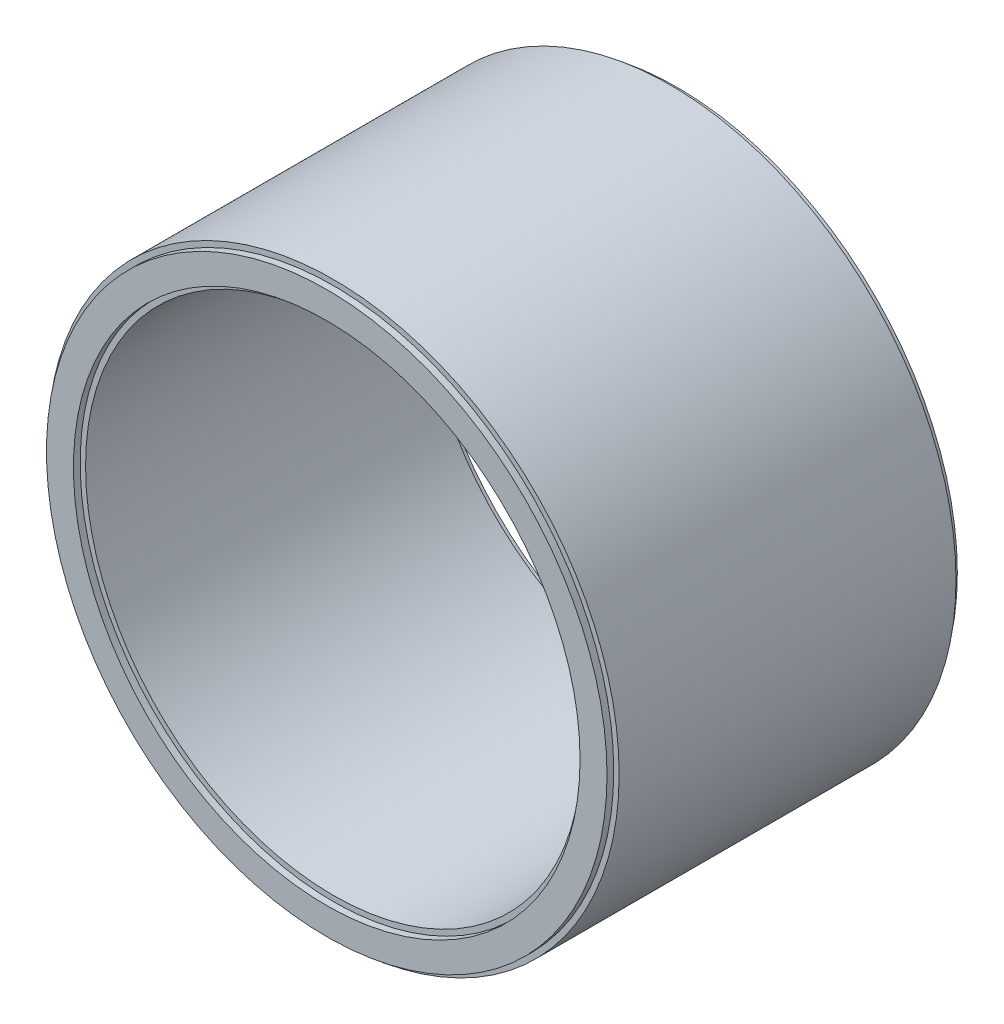
from build123d import *


with BuildPart() as part:
    # Esquisse2 → Révolution1 (revolve)
    with BuildSketch(Plane(origin=(0, 0, 0), x_dir=(0, 0, -1), z_dir=(1, 0, 0)), mode=Mode.PRIVATE) as r_volution1_sk:
        Polygon((-6.5, 10.4), (-6.25, 10.4), (-6.25, 10.6), (6.25, 10.6), (6.25, 10.4), (6.5, 10.4), (6.5, 9.4), (6.25, 9.4), (6.25, 9.2), (-6.25, 9.2), (-6.25, 9.4), (-6.5, 9.4), align=None)
    revolve(r_volution1_sk.sketch.rotate(Axis((0, 0, 6.88356419), (0, 0, -1)), 90), axis=Axis((0, 0, 6.88356419), (0, 0, -1)))


solid = part.part
